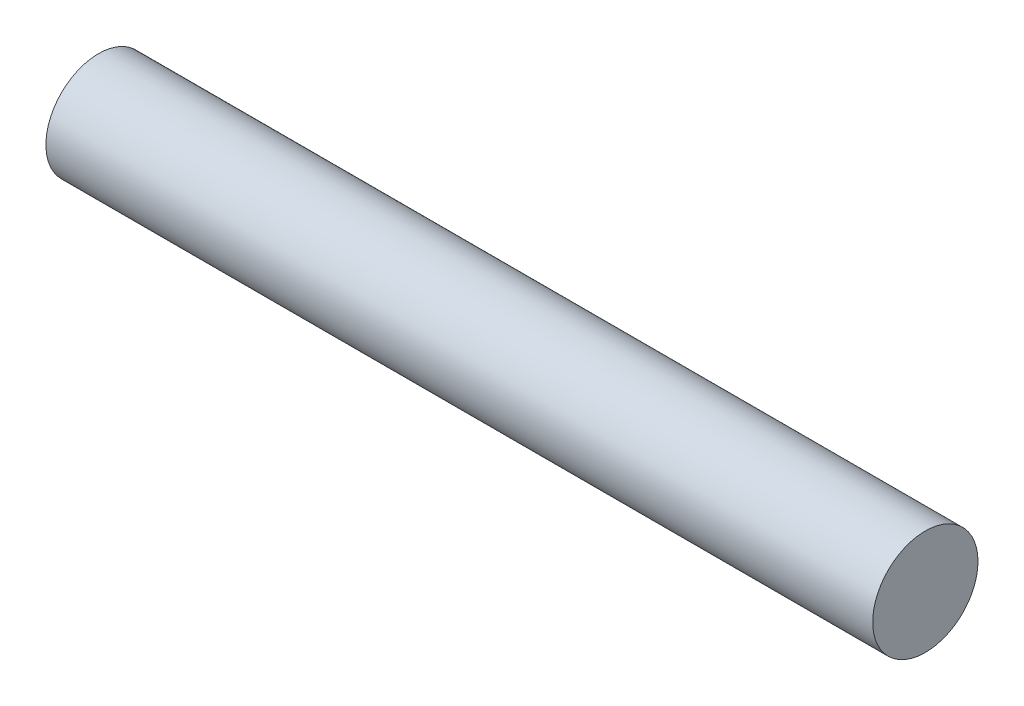
from build123d import *

# Parameters (mm, degrees)
SKETCH2_R           = 12.7
BOSS_EXTRUDE1_DEPTH = 199.39


with BuildPart() as part:
    # Sketch2 → Boss-Extrude1 (new body)
    with BuildSketch(Plane.YZ):
        with Locations(Location((0, 0, 0), (0, 0, 270))):
            Circle(SKETCH2_R)
    extrude(amount=BOSS_EXTRUDE1_DEPTH)


solid = part.part
